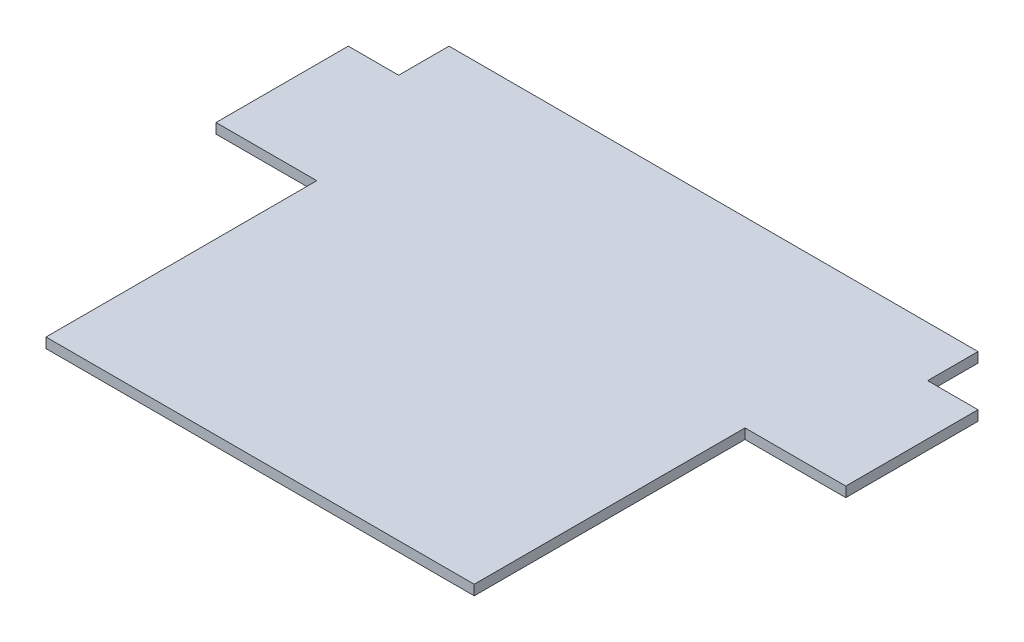
from build123d import *

# Parameters (mm, degrees)
BOSS_EXTRUDE1_DEPTH = 1.6


with BuildPart() as part:
    # Sketch1 → Boss-Extrude1 (new body)
    with BuildSketch(Plane(origin=(0, 0, 0), x_dir=(1, 0, 0), z_dir=(0, 1, 0))):
        Polygon((-34, 43), (-34, 0), (34, 0), (34, 43), (50, 43), (50, 64), (42, 64), (42, 72), (-42, 72), (-42, 64), (-50, 64), (-50, 43), align=None)
    extrude(amount=BOSS_EXTRUDE1_DEPTH)


solid = part.part
